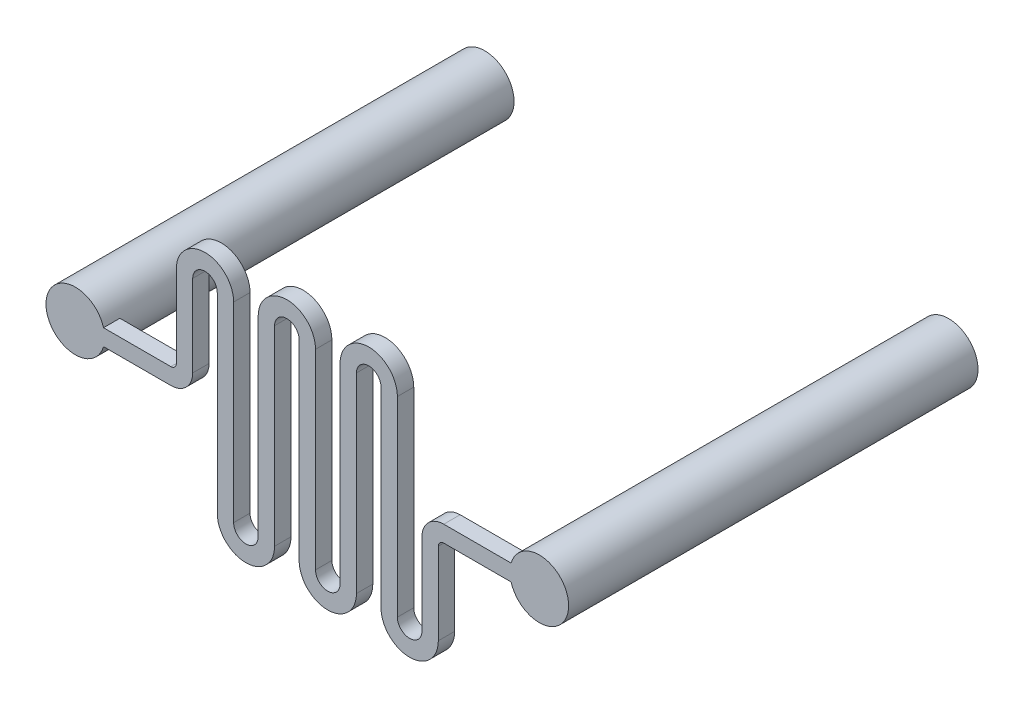
from build123d import *

# Parameters (mm, degrees)
BOSS_EXTRUDE1_DEPTH = 1.2
SKETCH3_W           = 2.15
SKETCH3_H           = 30
SKETCH4_W           = 2.15
SKETCH4_H           = 30
SKETCH5_R           = 1.5
CUT_EXTRUDE1_DEPTH  = 28


with BuildPart() as part:
    # Sketch2 → Boss-Extrude1 (new body)
    with BuildSketch(Plane.XY):
        with BuildLine():
            Line((-20.5, -0.6), (-13.5, -0.6))
            ThreePointArc((-13.5, -0.6), (-12.36862915, -0.13137085), (-11.9, 1))
            Line((-11.9, 1), (-11.9, 7))
            ThreePointArc((-11.9, 7), (-11, 7.9), (-10.1, 7))
            Line((-10.1, 7), (-10.1, 0))
            Line((-10.1, 0), (-10.1, -7))
            ThreePointArc((-10.1, -7), (-8, -9.1), (-5.9, -7))
            Line((-5.9, -7), (-5.9, 0))
            Line((-5.9, 0), (-5.9, 7))
            ThreePointArc((-5.9, 7), (-5, 7.9), (-4.1, 7))
            Line((-4.1, 7), (-4.1, 0))
            Line((-4.1, 0), (-4.1, -7))
            ThreePointArc((-4.1, -7), (-2, -9.1), (0.1, -7))
            Line((0.1, -7), (0.1, 0))
            Line((0.1, 0), (0.1, 7))
            ThreePointArc((0.1, 7), (1, 7.9), (1.9, 7))
            Line((1.9, 7), (1.9, 0))
            Line((1.9, 0), (1.9, -7))
            ThreePointArc((1.9, -7), (4, -9.1), (6.1, -7))
            Line((6.1, -7), (6.1, -1))
            ThreePointArc((6.1, -1), (6.217157288, -0.717157288), (6.5, -0.6))
            Line((6.5, -0.6), (13.5, -0.6))
            ThreePointArc((13.5, -0.6), (14.1, 0), (13.5, 0.6))
            Line((13.5, 0.6), (6.5, 0.6))
            ThreePointArc((6.5, 0.6), (5.36862915, 0.13137085), (4.9, -1))
            Line((4.9, -1), (4.9, -7))
            ThreePointArc((4.9, -7), (4, -7.9), (3.1, -7))
            Line((3.1, -7), (3.1, 0))
            Line((3.1, 0), (3.1, 7))
            ThreePointArc((3.1, 7), (1, 9.1), (-1.1, 7))
            Line((-1.1, 7), (-1.1, 0))
            Line((-1.1, 0), (-1.1, -7))
            ThreePointArc((-1.1, -7), (-2, -7.9), (-2.9, -7))
            Line((-2.9, -7), (-2.9, 0))
            Line((-2.9, 0), (-2.9, 7))
            ThreePointArc((-2.9, 7), (-5, 9.1), (-7.1, 7))
            Line((-7.1, 7), (-7.1, 0))
            Line((-7.1, 0), (-7.1, -7))
            ThreePointArc((-7.1, -7), (-8, -7.9), (-8.9, -7))
            Line((-8.9, -7), (-8.9, 0))
            Line((-8.9, 0), (-8.9, 7))
            ThreePointArc((-8.9, 7), (-11, 9.1), (-13.1, 7))
            Line((-13.1, 7), (-13.1, 1))
            ThreePointArc((-13.1, 1), (-13.217157288, 0.717157288), (-13.5, 0.6))
            Line((-13.5, 0.6), (-20.5, 0.6))
            ThreePointArc((-20.5, 0.6), (-21.1, 0), (-20.5, -0.6))
        make_face()
    extrude(amount=BOSS_EXTRUDE1_DEPTH)

    # Sketch3 → Revolve1 (revolve)
    with BuildSketch(Plane(origin=(0, 0, 0), x_dir=(1, 0, 0), z_dir=(0, 1, 0)), mode=Mode.PRIVATE) as revolve1_sk:
        with Locations((-21.575, 13.8)):
            Rectangle(SKETCH3_W, SKETCH3_H)
    revolve(revolve1_sk.sketch.rotate(Axis((-20.5, 0, 1.2), (0, 0, -1)), 180), axis=Axis((-20.5, 0, 1.2), (0, 0, -1)))

    # Sketch4 → Revolve2 (revolve)
    with BuildSketch(Plane(origin=(0, 0, 0), x_dir=(1, 0, 0), z_dir=(0, 1, 0))):
        with Locations((14.575, 13.8)):
            Rectangle(SKETCH4_W, SKETCH4_H)
    revolve(axis=Axis((13.5, 0, 1.2), (0, 0, -1)))

    # Sketch5 → Cut-Extrude1 (cut)
    with BuildSketch(Plane(origin=(0, 0, -28.8), x_dir=(-1, 0, 0), z_dir=(0, 0, -1))):
        with Locations((-13.5, 0)):
            Circle(SKETCH5_R)
        with Locations((20.5, 0)):
            Circle(SKETCH5_R)
    extrude(amount=-CUT_EXTRUDE1_DEPTH, mode=Mode.SUBTRACT)


solid = part.part
